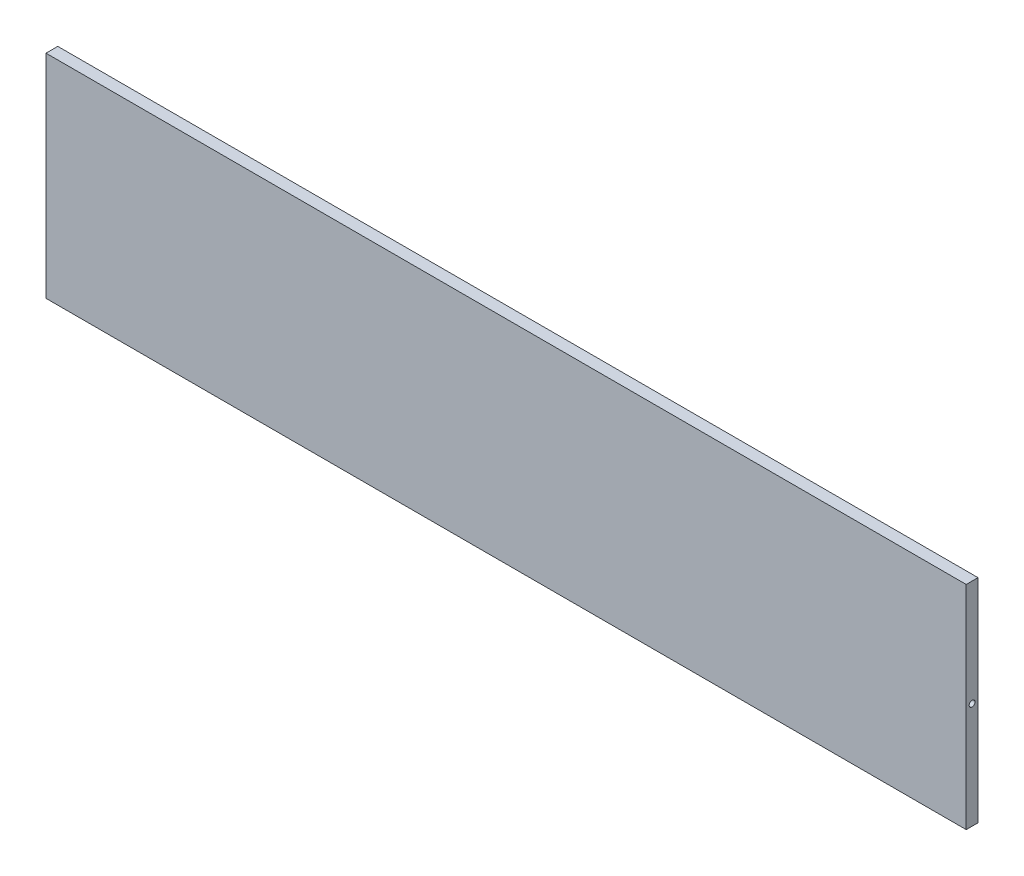
from build123d import *

# Parameters (mm, degrees)
SKETCH1_W           = 390
SKETCH1_H           = 90
BOSS_EXTRUDE1_DEPTH = 5
SKETCH2_R           = 1.25
CUT_EXTRUDE1_DEPTH  = 15
SKETCH3_R           = 1.25
CUT_EXTRUDE2_DEPTH  = 15
CUT_EXTRUDE3_START  = -15
SKETCH4_R           = 1.25
CUT_EXTRUDE3_DEPTH  = 15


with BuildPart() as part:
    # Sketch1 → Boss-Extrude1 (new body)
    with BuildSketch(Plane.XY):
        with Locations((195, 45)):
            Rectangle(SKETCH1_W, SKETCH1_H)
    extrude(amount=BOSS_EXTRUDE1_DEPTH)

    # Sketch2 → Cut-Extrude1 (cut)
    with BuildSketch(Plane.ZY):
        with Locations((2.5, 45)):
            Circle(SKETCH2_R)
    extrude(amount=-CUT_EXTRUDE1_DEPTH, mode=Mode.SUBTRACT)

    # Sketch3 → Cut-Extrude2 (cut)
    with BuildSketch(Plane(origin=(0, 0, 0), x_dir=(-1, 0, 0), z_dir=(0, -1, 0))):
        with Locations(Location((-35, -2.5, 0), (0, 0, 90))):
            Circle(SKETCH3_R)
        with Locations(Location((-355, -2.5, 0), (0, 0, 90))):
            Circle(SKETCH3_R)
    extrude(amount=-CUT_EXTRUDE2_DEPTH, mode=Mode.SUBTRACT)

    # Sketch4 → Cut-Extrude3 (cut)
    with BuildSketch(Plane(origin=(390, 0, 0), x_dir=(0, 0, -1), z_dir=(1, 0, 0)).offset(CUT_EXTRUDE3_START)):
        with Locations(Location((-2.5, 45, 0), (0, 0, 180))):
            Circle(SKETCH4_R)
    extrude(amount=CUT_EXTRUDE3_DEPTH, mode=Mode.SUBTRACT)


solid = part.part
